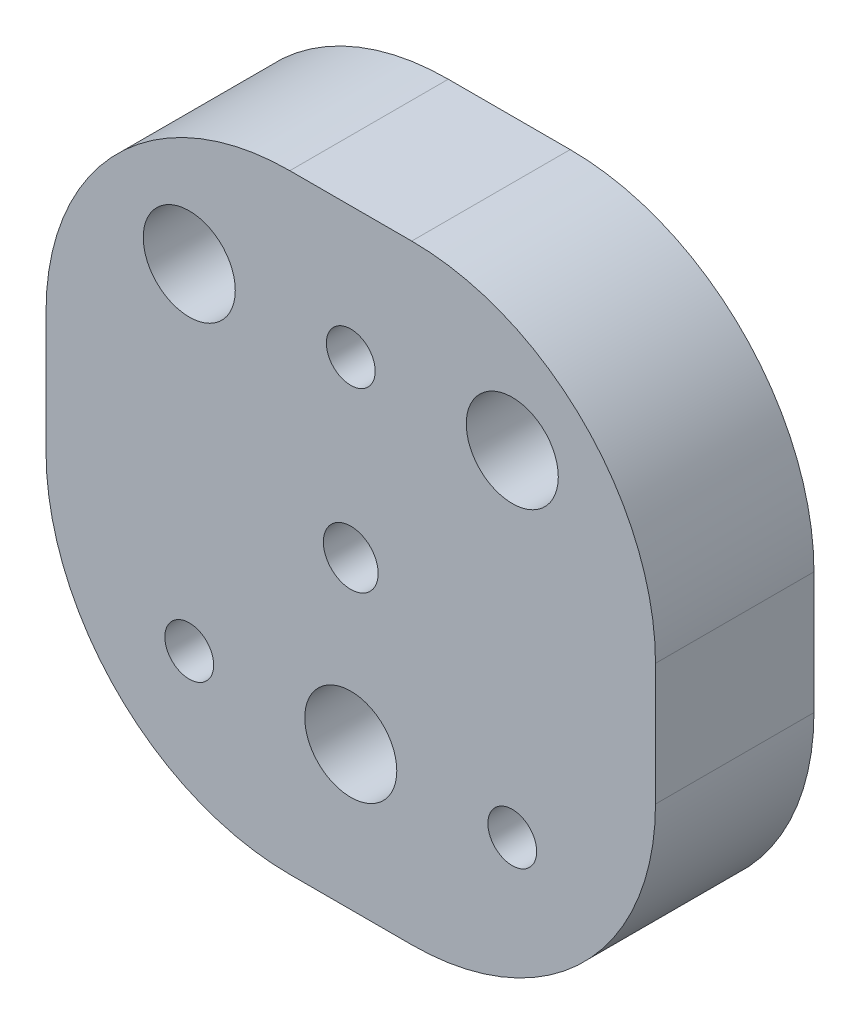
from build123d import *

# Parameters (mm, degrees)
SKETCH1_W               = 100
SKETCH1_H               = 100
BOSS_EXTRUDE1_DEPTH     = 26
SKETCH2_R               = 4.005
SKETCH2_R_2             = 4.5
CUT_EXTRUDE1_DEPTH      = 23
SKETCH4_R               = 7.55
CUT_EXTRUDE2_DEPTH      = 24
CUT_EXTRUDE3_DEPTH      = 76.339232807
CUT_EXTRUDE3_DEPTH_BACK = 76.339232807
SKETCH5_R               = 4.5
FILLET1_R               = 40


with BuildPart() as part:
    # Sketch1 → Boss-Extrude1 (new body)
    with BuildSketch(Plane.XY):
        Rectangle(SKETCH1_W, SKETCH1_H)
    extrude(amount=BOSS_EXTRUDE1_DEPTH)

    # Sketch2 → Cut-Extrude1 (cut)
    with BuildSketch(Plane.XY.offset(26)):
        with Locations((0, 28.499999998)):
            Circle(SKETCH2_R)
        with Locations((-26.5, -26.500000001)):
            Circle(SKETCH2_R)
        with Locations((26.5, -26.500000001)):
            Circle(SKETCH2_R)
        Circle(SKETCH2_R_2)
    extrude(amount=-CUT_EXTRUDE1_DEPTH, mode=Mode.SUBTRACT)

    # Sketch4 → Cut-Extrude2 (cut)
    with BuildSketch(Plane.XY.offset(26)):
        with Locations((-26.5, 28.499999998)):
            Circle(SKETCH4_R)
        with Locations((26.5, 28.499999998)):
            Circle(SKETCH4_R)
        with Locations((0, -26.500000002)):
            Circle(SKETCH4_R)
    extrude(amount=-CUT_EXTRUDE2_DEPTH, mode=Mode.SUBTRACT)

    # Sketch5 → Cut-Extrude3 (cut, two sides: drawn at the far end of the back side and taken through both)
    with BuildSketch(Plane.XY.offset(26).offset(-CUT_EXTRUDE3_DEPTH_BACK)):
        with Locations((-26.5, 28.499999998)):
            Circle(SKETCH5_R)
        with Locations((26.5, 28.499999998)):
            Circle(SKETCH5_R)
        with Locations((0, -26.500000002)):
            Circle(SKETCH5_R)
    extrude(amount=CUT_EXTRUDE3_DEPTH + CUT_EXTRUDE3_DEPTH_BACK, mode=Mode.SUBTRACT)

    # Fillet1
    fillet1_edges = [part.edges().sort_by_distance(p)[0] for p in [
        (50, -50, 13),
        (-50, -50, 13),
        (-50, 50, 13),
        (50, 50, 13),
    ]]
    fillet(fillet1_edges, radius=FILLET1_R)


solid = part.part
